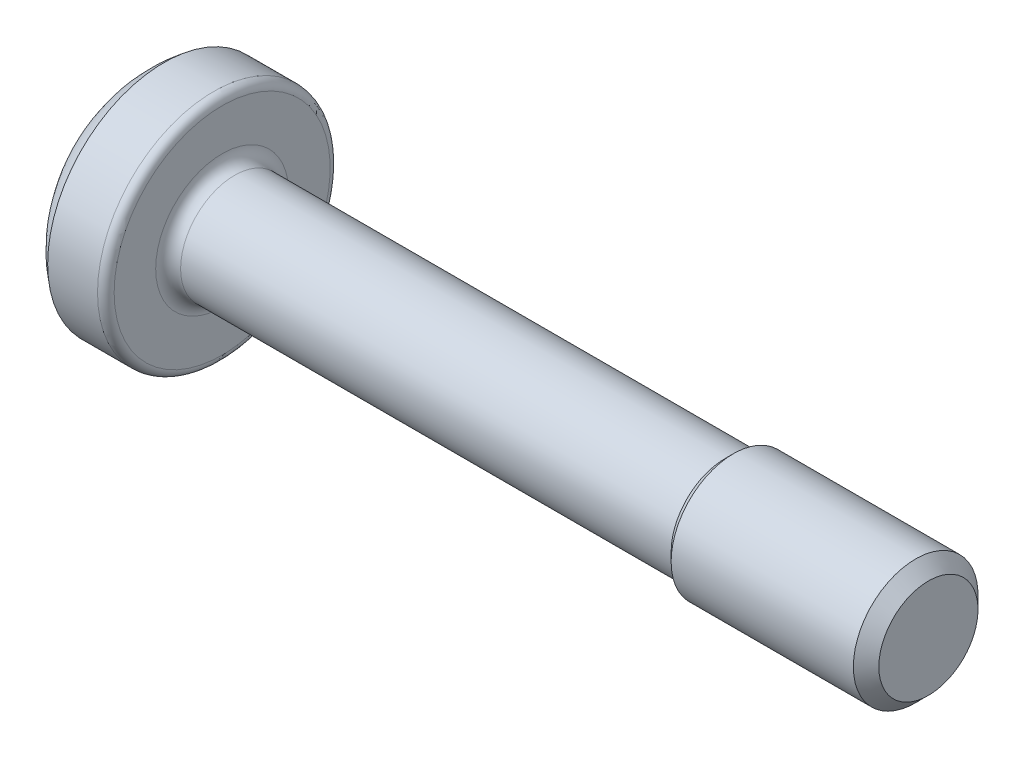
from build123d import *

# Parameters (mm, degrees)
SCHNITT_LINEAR_AUSTRAGEN1_DEPTH = 2.1


with BuildPart() as part:
    # Skizze1 → Rotation1 (revolve)
    with BuildSketch(Plane.XY):
        with BuildLine():
            Line((-2.4, 0), (-2.4, 1.4))
            ThreePointArc((-2.4, 1.4), (-2.010193737, 2.178709812), (-1.4, 2.8))
            Line((-1.4, 2.8), (-0.2, 2.8))
            ThreePointArc((-0.2, 2.8), (-0.058578644, 2.741421356), (0, 2.6))
            Line((0, 2.6), (0, 1.6))
            ThreePointArc((0, 1.6), (0.087867966, 1.387867966), (0.3, 1.3))
            Line((0.3, 1.3), (12.1065, 1.3))
            Line((12.1065, 1.3), (12.3065, 1.5))
            Line((12.3065, 1.5), (16.6935, 1.5))
            Line((16.6935, 1.5), (17, 1.1935))
            Line((17, 1.1935), (17, 0))
            Line((17, 0), (-2.4, 0))
        make_face()
    revolve(axis=Axis((17, 0, 0), (-1, 0, 0)))

    # Skizze2 → Schnitt-Linear austragen1 (cut)
    with BuildSketch(Plane.ZY.offset(2.4)):
        with BuildLine():
            Line((0.38, -2.014472636), (0.38, -0.975538848))
            ThreePointArc((0.38, -0.975538848), (0.613182892, -0.826946318), (0.88968299, -0.828248869))
            ThreePointArc((0.88968299, -0.828248869), (1.212435563, -0.700000005), (1.162126064, -0.356363644))
            ThreePointArc((1.162126064, -0.356363644), (1.008436863, -6e-09), (1.162126056, 0.356363636))
            ThreePointArc((1.162126056, 0.356363636), (1.212435568, 0.699999995), (0.889683001, 0.828248872))
            ThreePointArc((0.889683001, 0.828248872), (0.613182897, 0.826946316), (0.38, 0.975538848))
            Line((0.38, 0.975538848), (0.38, 2.014472636))
            ThreePointArc((0.38, 2.014472636), (0, 2.05), (-0.38, 2.014472636))
            Line((-0.38, 2.014472636), (-0.38, 0.975538848))
            ThreePointArc((-0.38, 0.975538848), (-0.613182887, 0.826946319), (-0.889682981, 0.828248866))
            ThreePointArc((-0.889682981, 0.828248866), (-1.212435565, 0.700000001), (-1.162126051, 0.356363631))
            ThreePointArc((-1.162126051, 0.356363631), (-1.008436863, -7e-09), (-1.162126061, -0.356363641))
            ThreePointArc((-1.162126061, -0.356363641), (-1.212435561, -0.700000008), (-0.889682979, -0.828248866))
            ThreePointArc((-0.889682979, -0.828248866), (-0.613182886, -0.826946319), (-0.38, -0.975538848))
            Line((-0.38, -0.975538848), (-0.38, -2.014472636))
            ThreePointArc((-0.38, -2.014472636), (0, -2.05), (0.38, -2.014472636))
        make_face()
    extrude(amount=-SCHNITT_LINEAR_AUSTRAGEN1_DEPTH, mode=Mode.SUBTRACT)

    # Skizze3 → Schnitt-Rotation1 (revolve, cut)
    with BuildSketch(Plane.XY):
        Polygon((-2.4, 0), (-2.4, 1.4), (-1, 0), align=None)
    revolve(axis=Axis((-1, 0, 0), (-1, 0, 0)), mode=Mode.SUBTRACT)


solid = part.part
